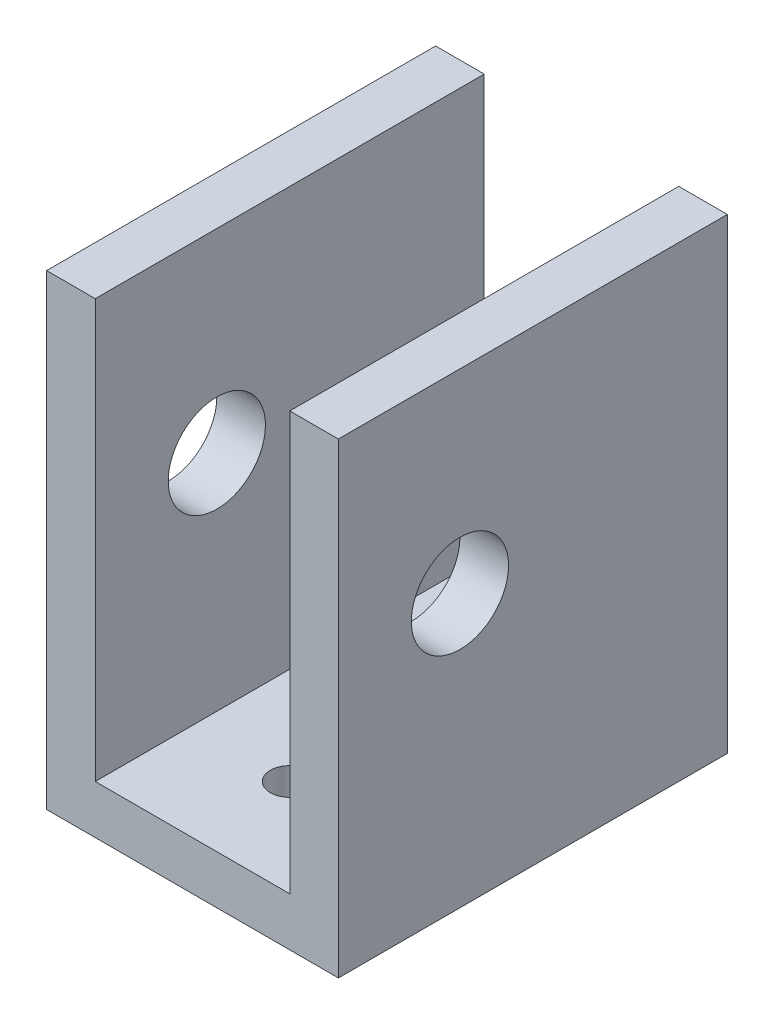
from build123d import *

# Parameters (mm, degrees)
SKETCH1_W           = 19.05
SKETCH1_H           = 38.1
SKETCH1_W_2         = 12.7
SKETCH1_H_2         = 31.75
BOSS_EXTRUDE1_DEPTH = 12.7
SKETCH2_R           = 2.54
CUT_EXTRUDE1_DEPTH  = 76.2
SKETCH3_R           = 3.175
CUT_EXTRUDE2_DEPTH  = 30.784140075
SKETCH4_W           = 25.4
SKETCH4_H           = 7.62
CUT_EXTRUDE3_DEPTH  = 30.784140075
SKETCH5_R           = 1.27
CUT_EXTRUDE4_DEPTH  = 35.366350184


with BuildPart() as part:
    # Sketch1 → Boss-Extrude1 (new, symmetric)
    with BuildSketch(Plane.XY):
        Rectangle(SKETCH1_W, SKETCH1_H)
        Rectangle(SKETCH1_W_2, SKETCH1_H_2, mode=Mode.SUBTRACT)
    extrude(amount=BOSS_EXTRUDE1_DEPTH, both=True)

    # Sketch2 → Cut-Extrude1 (cut)
    with BuildSketch(Plane.XZ.offset(19.05)):
        with Locations(Location((0, 0, 0), (0, 0, 270))):
            Circle(SKETCH2_R)
    extrude(amount=-CUT_EXTRUDE1_DEPTH, mode=Mode.SUBTRACT)

    # Sketch3 → Cut-Extrude2 (cut, through all)
    with BuildSketch(Plane(origin=(9.525, 0, 0), x_dir=(0, 0, -1), z_dir=(1, 0, 0))):
        with Locations((-4.7625, -1.27)):
            Circle(SKETCH3_R)
    extrude(amount=-CUT_EXTRUDE2_DEPTH, mode=Mode.SUBTRACT)

    # Sketch4 → Cut-Extrude3 (cut, through all)
    with BuildSketch(Plane(origin=(9.525, 0, 0), x_dir=(0, 0, -1), z_dir=(1, 0, 0))):
        with Locations((0, 15.24)):
            Rectangle(SKETCH4_W, SKETCH4_H)
    extrude(amount=-CUT_EXTRUDE3_DEPTH, mode=Mode.SUBTRACT)

    # Sketch5 → Cut-Extrude4 (cut, through all)
    with BuildSketch(Plane.XZ.offset(19.05)):
        with Locations(Location((0, -6.35, 0), (0, 0, 270))):
            Circle(SKETCH5_R)
        with Locations(Location((0, 6.35, 0), (0, 0, 270))):
            Circle(SKETCH5_R)
    extrude(amount=-CUT_EXTRUDE4_DEPTH, mode=Mode.SUBTRACT)


solid = part.part
